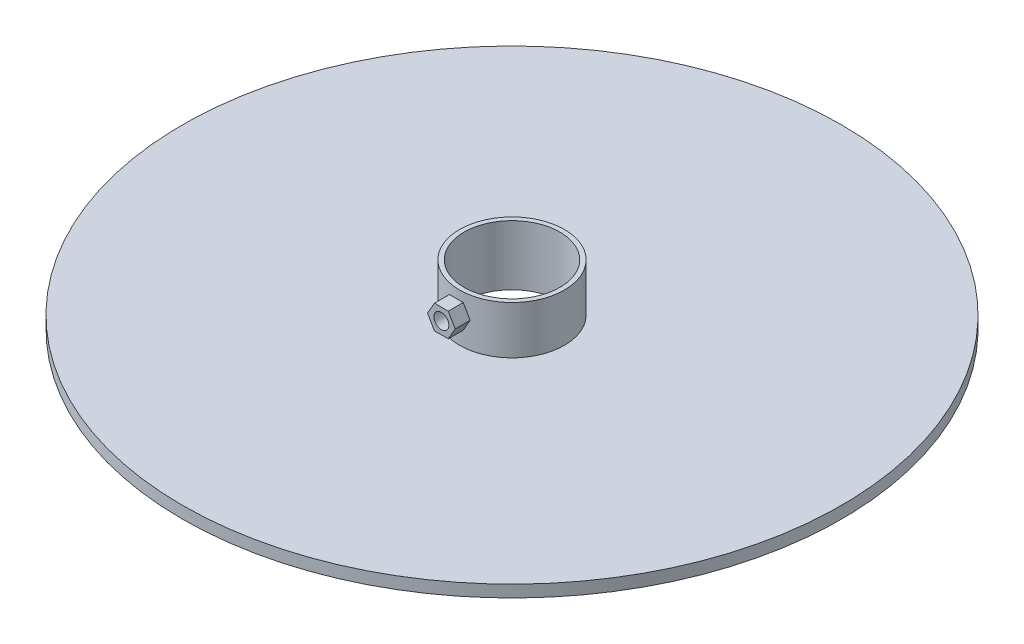
from build123d import *

# Parameters (mm, degrees)
CUT_EXTRUDE1_REACH      = 653.637
CUT_EXTRUDE1_END_RADIUS = 16
SKETCH3_R               = 3
SKETCH4_R               = 2.5
BOSS_EXTRUDE1_DEPTH     = 5


with BuildPart() as part:
    # Sketch1 → Revolve1 (revolve)
    with BuildSketch(Plane(origin=(0, 0, 0), x_dir=(0, 0, -1), z_dir=(1, 0, 0)), mode=Mode.PRIVATE) as revolve1_sk:
        Polygon((17.5, -625.502918688), (17.5, -609.502918688), (16, -609.502918688), (16, -629.502918688), (110, -629.502918688), (110, -625.502918688), align=None)
    revolve(revolve1_sk.sketch.rotate(Axis((0, 0, 0), (0, -1, 0)), 180), axis=Axis((0, 0, 0), (0, -1, 0)))

    # Cut-Extrude1: up to this cylinder (the profile starts outside it)
    cut_extrude1_end = Plane(origin=(0, -616.502919, 0), z_dir=(0, 1, 0)) * Cylinder(CUT_EXTRUDE1_END_RADIUS, 1340.274, mode=Mode.PRIVATE)
    # Sketch3 → Cut-Extrude1 (cut, up to the surface)
    with BuildSketch(Plane.XY.offset(17.5), mode=Mode.PRIVATE) as cut_extrude1_sk1:
        with Locations((-1.082153425, -616.502918688)):
            Circle(SKETCH3_R)
    cut_extrude1_tool1 = extrude(cut_extrude1_sk1.sketch, amount=-CUT_EXTRUDE1_REACH, mode=Mode.PRIVATE) - cut_extrude1_end
    add(cut_extrude1_tool1.solids().sort_by_distance((-1.082153, -616.502919, 17.5))[0], mode=Mode.SUBTRACT)


with BuildPart() as body_2:
    # Sketch4 → Boss-Extrude1 (new body)
    with BuildSketch(Plane.XY.offset(17.5)):
        Polygon((3.536648728, -616.502918688), (1.227247651, -612.502918688), (-3.391554502, -612.502918688), (-5.700955579, -616.502918688), (-3.391554502, -620.502918688), (1.227247651, -620.502918688), align=None)
        with Locations((-1.082153425, -616.502918688)):
            Circle(SKETCH4_R, mode=Mode.SUBTRACT)
    extrude(amount=BOSS_EXTRUDE1_DEPTH)


solid = Compound([part.part, body_2.part])
